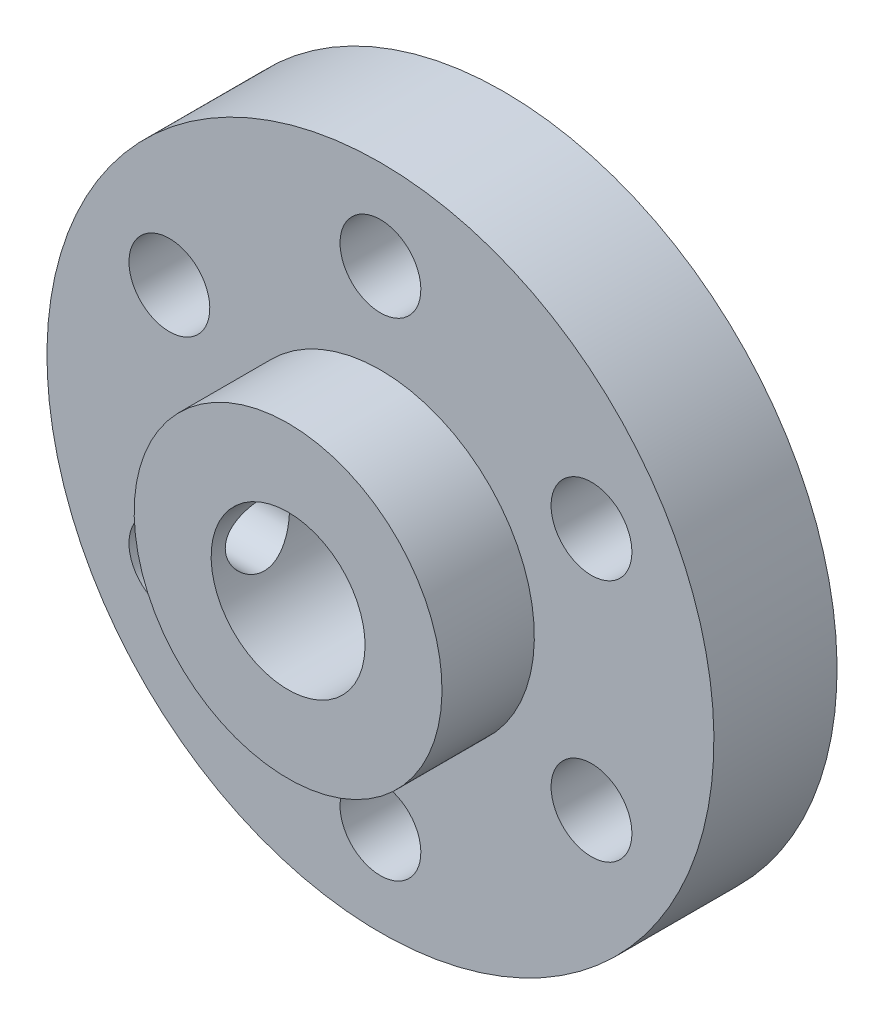
from build123d import *

# Parameters (mm, degrees)
TAP_DRILL_FOR_M3_HELICOIL1_D     = 3.15
TAP_DRILL_FOR_M3_HELICOIL1_DEPTH = 10
TAP_DRILL_FOR_M3_HELICOIL1_TIP   = 0.946355475
CUT_EXTRUDE3_REACH               = 22.213
SKETCH2_R                        = 1.25


with BuildPart() as part:
    # Sketch1 → Revolve1 (revolve)
    with BuildSketch(Plane(origin=(0, 0, 0), x_dir=(0, 0, -1), z_dir=(1, 0, 0))):
        Polygon((0, 3), (-8.4, 3), (-8.4, 6), (-4.8, 6), (-4.8, 13), (0, 13), align=None)
    revolve(axis=Axis((0, 0, 6.17319531), (0, 0, 1)))

    # Tap Drill for M3 Helicoil1
    with Locations(Plane(origin=(0, -9.5, 4.8), x_dir=(0, 1, 0), z_dir=(0, 0, 1))):
        with Locations((0, 0), (4.75, -8.227241336), (14.25, -8.227241336), (19, 0), (14.25, 8.227241336), (4.75, 8.227241336)):
            Hole(TAP_DRILL_FOR_M3_HELICOIL1_D / 2, depth=TAP_DRILL_FOR_M3_HELICOIL1_DEPTH)
            with Locations((0, 0, -(TAP_DRILL_FOR_M3_HELICOIL1_DEPTH + TAP_DRILL_FOR_M3_HELICOIL1_TIP / 2))):  # 118° drill point
                Cone(0, TAP_DRILL_FOR_M3_HELICOIL1_D / 2, TAP_DRILL_FOR_M3_HELICOIL1_TIP, mode=Mode.SUBTRACT)

    # Sketch2 → Cut-Extrude3 (cut, up to next)
    with BuildSketch(Plane(origin=(0, 0, 0), x_dir=(0, 0, -1), z_dir=(1, 0, 0)), mode=Mode.PRIVATE) as cut_extrude3_sk1:
        with Locations((-2.4, 0)):
            Circle(SKETCH2_R)
    cut_extrude3_tool1 = extrude(cut_extrude3_sk1.sketch, amount=-CUT_EXTRUDE3_REACH, mode=Mode.PRIVATE) & part.part
    # Sketch2 → Cut-Extrude3 (cut, up to next)
    with BuildSketch(Plane(origin=(0, 0, 0), x_dir=(0, 0, -1), z_dir=(1, 0, 0)), mode=Mode.PRIVATE) as cut_extrude3_sk2:
        with Locations((-6.6, 0)):
            Circle(SKETCH2_R)
    cut_extrude3_tool2 = extrude(cut_extrude3_sk2.sketch, amount=-CUT_EXTRUDE3_REACH, mode=Mode.PRIVATE) & part.part
    add(cut_extrude3_tool1.solids().sort_by_distance((0, 0, 2.4))[0], mode=Mode.SUBTRACT)
    add(cut_extrude3_tool2.solids().sort_by_distance((0, 0, 6.6))[0], mode=Mode.SUBTRACT)


solid = part.part
